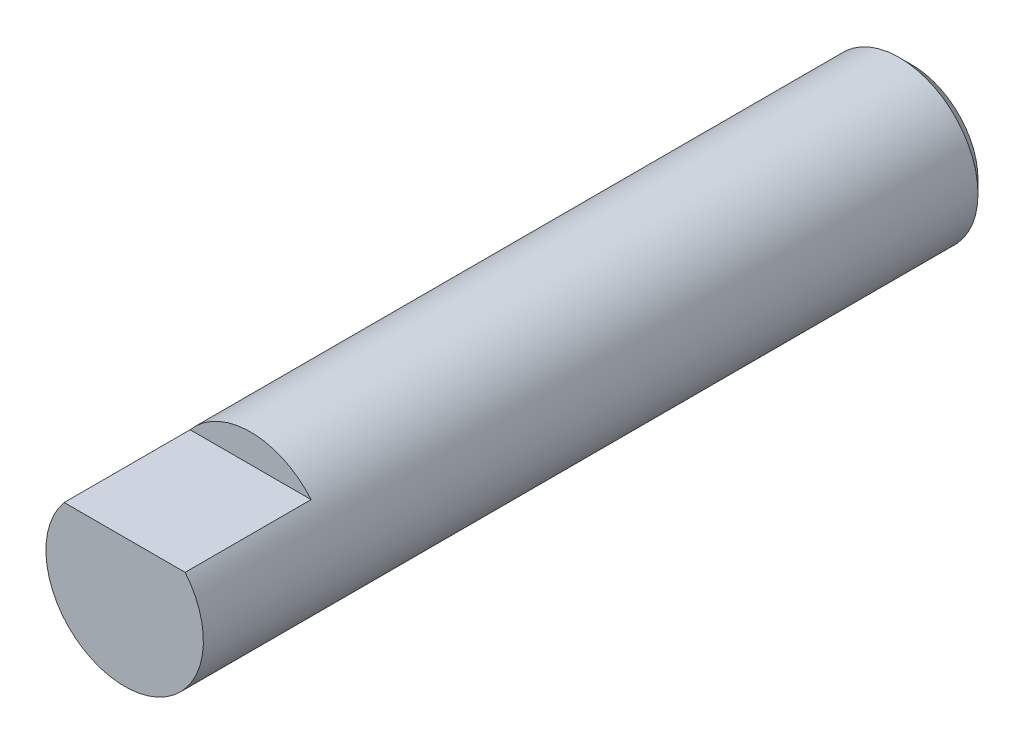
from build123d import *

# Parameters (mm, degrees)
SKETCH1_R           = 12.5
BOSS_EXTRUDE1_DEPTH = 125
CUT_EXTRUDE1_START  = -20
CUT_EXTRUDE1_DEPTH  = 20
CHAMFER1_SIZE       = 2


with BuildPart() as part:
    # Sketch1 → Boss-Extrude1 (new body)
    with BuildSketch(Plane.XY):
        Circle(SKETCH1_R)
    extrude(amount=BOSS_EXTRUDE1_DEPTH)

    # Sketch2 → Cut-Extrude1 (cut)
    with BuildSketch(Plane.XY.offset(125).offset(CUT_EXTRUDE1_START)):
        with BuildLine():
            Line((-9.604686356, 8), (9.604686356, 8))
            ThreePointArc((9.604686356, 8), (0, 12.5), (-9.604686356, 8))
        make_face()
    extrude(amount=CUT_EXTRUDE1_DEPTH, mode=Mode.SUBTRACT)

    # Chamfer1
    chamfer1_edges = [part.edges().sort_by_distance(p)[0] for p in [
        (-12.5, 0, 0),
    ]]
    chamfer(chamfer1_edges, length=CHAMFER1_SIZE)


solid = part.part
